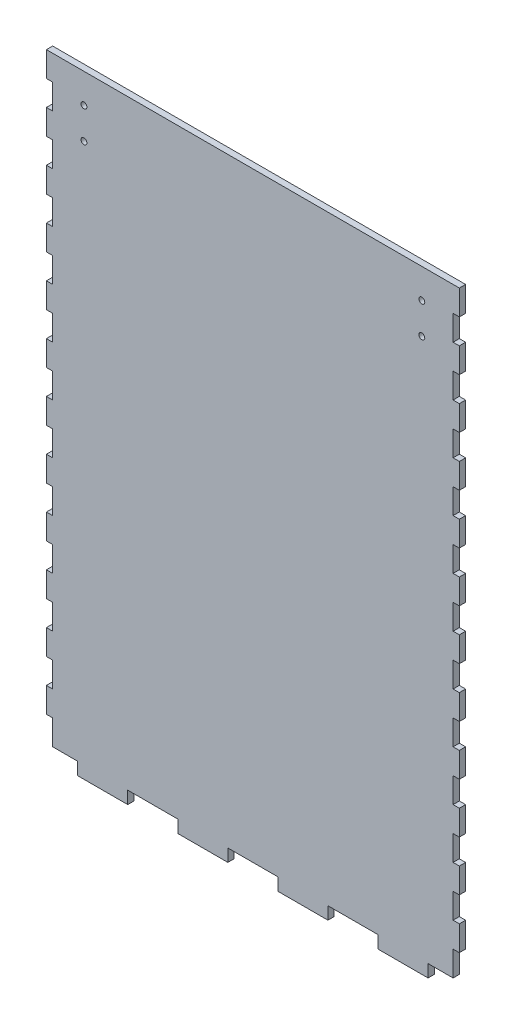
from build123d import *

# Parameters (mm, degrees)
SKETCH1_W           = 203.2
SKETCH1_H           = 304.8
BOSS_EXTRUDE1_DEPTH = 3.175
SKETCH2_W           = 3.175
SKETCH2_H           = 12.7
SKETCH2_W_2         = 25.4
SKETCH2_H_2         = 6.35
BOSS_EXTRUDE2_DEPTH = 3.175
SKETCH5_R           = 1.5
CUT_EXTRUDE2_DEPTH  = 3.175


with BuildPart() as part:
    # Sketch1 → Boss-Extrude1 (new body)
    with BuildSketch(Plane.XY):
        with Locations((101.6, 152.4)):
            Rectangle(SKETCH1_W, SKETCH1_H)
    extrude(amount=BOSS_EXTRUDE1_DEPTH)

    # Sketch2 → Boss-Extrude2 (add)
    with BuildSketch(Plane.XY.offset(3.175)):
        with Locations((-1.5875, 298.45)):
            Rectangle(SKETCH2_W, SKETCH2_H)
        with Locations((204.7875, 298.45)):
            Rectangle(SKETCH2_W, SKETCH2_H)
        with Locations((-1.5875, 273.05)):
            Rectangle(SKETCH2_W, SKETCH2_H)
        with Locations((204.7875, 273.05)):
            Rectangle(SKETCH2_W, SKETCH2_H)
        with Locations((-1.5875, 247.65)):
            Rectangle(SKETCH2_W, SKETCH2_H)
        with Locations((204.7875, 247.65)):
            Rectangle(SKETCH2_W, SKETCH2_H)
        with Locations((-1.5875, 222.25)):
            Rectangle(SKETCH2_W, SKETCH2_H)
        with Locations((204.7875, 222.25)):
            Rectangle(SKETCH2_W, SKETCH2_H)
        with Locations((-1.5875, 196.85)):
            Rectangle(SKETCH2_W, SKETCH2_H)
        with Locations((204.7875, 196.85)):
            Rectangle(SKETCH2_W, SKETCH2_H)
        with Locations((-1.5875, 171.45)):
            Rectangle(SKETCH2_W, SKETCH2_H)
        with Locations((204.7875, 171.45)):
            Rectangle(SKETCH2_W, SKETCH2_H)
        with Locations((-1.5875, 146.05)):
            Rectangle(SKETCH2_W, SKETCH2_H)
        with Locations((204.7875, 146.05)):
            Rectangle(SKETCH2_W, SKETCH2_H)
        with Locations((-1.5875, 120.65)):
            Rectangle(SKETCH2_W, SKETCH2_H)
        with Locations((204.7875, 120.65)):
            Rectangle(SKETCH2_W, SKETCH2_H)
        with Locations((-1.5875, 95.25)):
            Rectangle(SKETCH2_W, SKETCH2_H)
        with Locations((204.7875, 95.25)):
            Rectangle(SKETCH2_W, SKETCH2_H)
        with Locations((-1.5875, 69.85)):
            Rectangle(SKETCH2_W, SKETCH2_H)
        with Locations((204.7875, 69.85)):
            Rectangle(SKETCH2_W, SKETCH2_H)
        with Locations((-1.5875, 44.45)):
            Rectangle(SKETCH2_W, SKETCH2_H)
        with Locations((204.7875, 44.45)):
            Rectangle(SKETCH2_W, SKETCH2_H)
        with Locations((-1.5875, 19.05)):
            Rectangle(SKETCH2_W, SKETCH2_H)
        with Locations((204.7875, 19.05)):
            Rectangle(SKETCH2_W, SKETCH2_H)
        with Locations((25.4, -3.175)):
            Rectangle(SKETCH2_W_2, SKETCH2_H_2)
        with Locations((76.2, -3.175)):
            Rectangle(SKETCH2_W_2, SKETCH2_H_2)
        with Locations((127, -3.175)):
            Rectangle(SKETCH2_W_2, SKETCH2_H_2)
        with Locations((177.8, -3.175)):
            Rectangle(SKETCH2_W_2, SKETCH2_H_2)
    extrude(amount=-BOSS_EXTRUDE2_DEPTH)

    # Sketch5 → Cut-Extrude2 (cut)
    with BuildSketch(Plane(origin=(0, 0, 0), x_dir=(-1, 0, 0), z_dir=(0, 0, -1))):
        with Locations((-187.325, 289.8)):
            Circle(SKETCH5_R)
        with Locations((-187.325, 274.05)):
            Circle(SKETCH5_R)
        with Locations(Location((-15.875, 274.05, 0), (0, 0, 180))):
            Circle(SKETCH5_R)
        with Locations(Location((-15.875, 289.8, 0), (0, 0, 180))):
            Circle(SKETCH5_R)
    extrude(amount=-CUT_EXTRUDE2_DEPTH, mode=Mode.SUBTRACT)


solid = part.part
